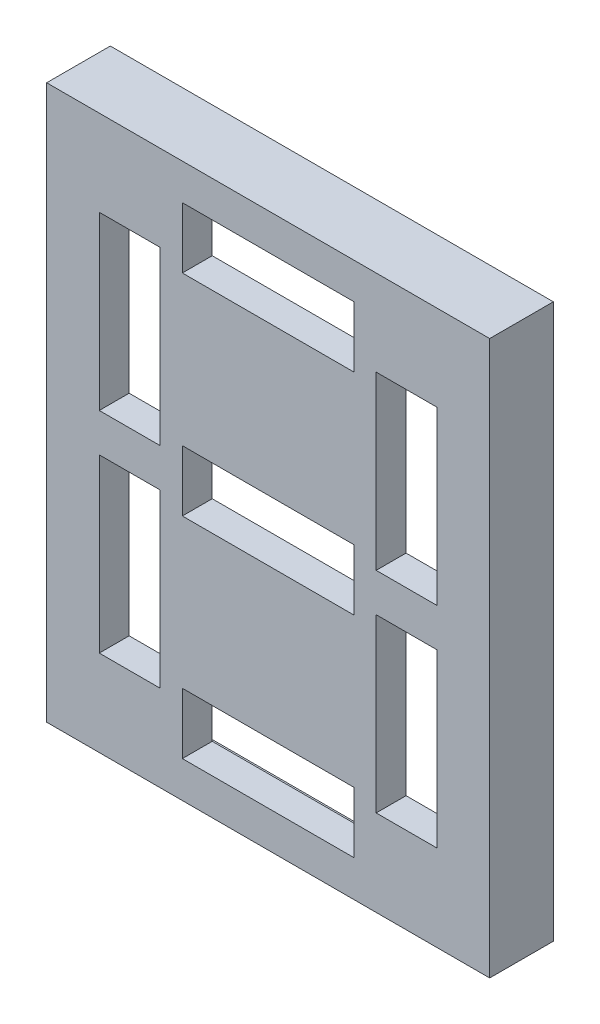
from build123d import *

# Parameters (mm, degrees)
SKETCH1_W             = 11
SKETCH1_H             = 31
BOSS_EXTRUDE1_DEPTH   = 3.81
SKETCH1_W_2           = 31
SKETCH1_H_2           = 11
BOSS_EXTRUDE1_2_DEPTH = 3.81
BOSS_EXTRUDE1_3_DEPTH = 3.81
BOSS_EXTRUDE1_4_DEPTH = 3.81
BOSS_EXTRUDE1_5_DEPTH = 3.81
SKETCH1_W_3           = 80
SKETCH1_H_3           = 100
SKETCH1_W_4           = 78.5
SKETCH1_H_4           = 98.5
BOSS_EXTRUDE1_6_DEPTH = 3.81
SKETCH3_W             = 80
SKETCH3_H             = 100
SKETCH3_W_2           = 31
SKETCH3_H_2           = 11
SKETCH3_W_3           = 11
SKETCH3_H_3           = 31
BOSS_EXTRUDE2_DEPTH   = 1.5875
FILLET1_R             = 0.05
SKETCH9_W             = 80
SKETCH9_H             = 100
BOSS_EXTRUDE6_DEPTH   = 6.096


with BuildPart() as part:
    # Sketch1 → Boss-Extrude1 (new body)
    with BuildSketch(Plane.XY):
        Polygon((-26.313903431, 0.439060111), (-31.5, 2.5), (-31.5, 35.5), (-25.083245041, 38.05), (-18.5, 35.5), (-18.5, 2.5), (-23.846750882, 0.428952262), (-23.616775358, 0.03062297), (-23.846750882, -0.367706323), (-18.5, -2.438754061), (-18.5, -35.438754061), (-25.083245041, -37.988754061), (-31.5, -35.438754061), (-31.5, -2.438754061), (-26.313903431, -0.377814172), (-26.549714725, 0.03062297), align=None)
        with Locations((-25, -18.938754061)):
            Rectangle(SKETCH1_W, SKETCH1_H, mode=Mode.SUBTRACT)
        with Locations((-25, 19)):
            Rectangle(SKETCH1_W, SKETCH1_H, mode=Mode.SUBTRACT)
    extrude(amount=BOSS_EXTRUDE1_DEPTH)



with BuildPart() as body_2:
    # Sketch1 → Boss-Extrude1 2 (new body)
    with BuildSketch(Plane.XY):
        Polygon((-19.05, 0.03062297), (-16.5, 6.5), (16.5, 6.5), (19.05, 0.03062297), (16.5, -6.438754061), (-16.5, -6.438754061), align=None)
        Rectangle(SKETCH1_W_2, SKETCH1_H_2, mode=Mode.SUBTRACT)
    extrude(amount=BOSS_EXTRUDE1_2_DEPTH)


with BuildPart() as body_3:
    # Sketch1 → Boss-Extrude1 3 (new body)
    with BuildSketch(Plane.XY):
        Polygon((26.313903431, 0.439060111), (26.549714725, 0.03062297), (26.313903431, -0.377814172), (31.5, -2.438754061), (31.5, -35.438754061), (25.083245041, -37.988754061), (18.5, -35.438754061), (18.5, -2.438754061), (23.846750882, -0.367706323), (23.616775358, 0.03062297), (23.846750882, 0.428952262), (18.5, 2.5), (18.5, 35.5), (25.083245041, 38.05), (31.5, 35.5), (31.5, 2.5), align=None)
        with Locations((25, 19)):
            Rectangle(SKETCH1_W, SKETCH1_H, mode=Mode.SUBTRACT)
        with Locations((25, -18.938754061)):
            Rectangle(SKETCH1_W, SKETCH1_H, mode=Mode.SUBTRACT)
    extrude(amount=BOSS_EXTRUDE1_3_DEPTH)


with BuildPart() as body_4:
    # Sketch1 → Boss-Extrude1 4 (new body)
    with BuildSketch(Plane.XY):
        Polygon((-16.5, 31.52602227), (-19.05, 38.013011135), (-16.5, 44.5), (16.5, 44.5), (19.05, 38.013011135), (16.5, 31.52602227), align=None)
        with Locations((0, 38)):
            Rectangle(SKETCH1_W_2, SKETCH1_H_2, mode=Mode.SUBTRACT)
    extrude(amount=BOSS_EXTRUDE1_4_DEPTH)


with BuildPart() as body_5:
    # Sketch1 → Boss-Extrude1 5 (new body)
    with BuildSketch(Plane.XY):
        Polygon((16.5, -31.464776331), (19.05, -37.951765196), (16.5, -44.438754061), (-16.5, -44.438754061), (-19.05, -37.951765196), (-16.5, -31.464776331), align=None)
        with Locations((0, -37.938754061)):
            Rectangle(SKETCH1_W_2, SKETCH1_H_2, mode=Mode.SUBTRACT)
    extrude(amount=BOSS_EXTRUDE1_5_DEPTH)


with BuildPart() as body_6:
    # Sketch1 → Boss-Extrude1 6 (new body)
    with BuildSketch(Plane.XY):
        Rectangle(SKETCH1_W_3, SKETCH1_H_3)
        Rectangle(SKETCH1_W_4, SKETCH1_H_4, mode=Mode.SUBTRACT)
    extrude(amount=BOSS_EXTRUDE1_6_DEPTH)


with BuildPart() as part_1:
    add(part.part)

    add(body_2.part)  # Boss-Extrude2 merges body 2

    add(body_3.part)  # Boss-Extrude2 merges body 3

    add(body_4.part)  # Boss-Extrude2 merges body 4

    add(body_5.part)  # Boss-Extrude2 merges body 5

    add(body_6.part)  # Boss-Extrude2 merges body 6
    # Sketch3 → Boss-Extrude2 (add)
    with BuildSketch(Plane.XY.offset(3.81)):
        Rectangle(SKETCH3_W, SKETCH3_H)
        with Locations((0, -37.938754061)):
            Rectangle(SKETCH3_W_2, SKETCH3_H_2, mode=Mode.SUBTRACT)
        Rectangle(SKETCH3_W_2, SKETCH3_H_2, mode=Mode.SUBTRACT)
        with Locations((-25, -18.938754061)):
            Rectangle(SKETCH3_W_3, SKETCH3_H_3, mode=Mode.SUBTRACT)
        with Locations((-25, 19)):
            Rectangle(SKETCH3_W_3, SKETCH3_H_3, mode=Mode.SUBTRACT)
        with Locations((0, 38)):
            Rectangle(SKETCH3_W_2, SKETCH3_H_2, mode=Mode.SUBTRACT)
        with Locations((25, 19)):
            Rectangle(SKETCH3_W_3, SKETCH3_H_3, mode=Mode.SUBTRACT)
        with Locations((25, -18.938754061)):
            Rectangle(SKETCH3_W_3, SKETCH3_H_3, mode=Mode.SUBTRACT)
    extrude(amount=BOSS_EXTRUDE2_DEPTH)

    # Fillet1
    fillet1_edges = [part_1.edges().sort_by_distance(p)[0] for p in [
        (39.25, 49.25, 1.905),
        (39.25, -49.25, 1.905),
        (-39.25, -49.25, 1.905),
        (-39.25, 49.25, 1.905),
    ]]
    fillet(fillet1_edges, radius=FILLET1_R)

    # Sketch9 → Boss-Extrude6 (add)
    with BuildSketch(Plane(origin=(0, 0, 0), x_dir=(-1, 0, 0), z_dir=(0, 0, -1))):
        Rectangle(SKETCH9_W, SKETCH9_H)
        with BuildLine():
            Line((39.2, 49.25), (-39.2, 49.25))
            ThreePointArc((-39.2, 49.25), (-39.235355339, 49.235355339), (-39.25, 49.2))
            Line((-39.25, 49.2), (-39.25, -49.2))
            ThreePointArc((-39.25, -49.2), (-39.235355339, -49.235355339), (-39.2, -49.25))
            Line((-39.2, -49.25), (39.2, -49.25))
            ThreePointArc((39.2, -49.25), (39.235355339, -49.235355339), (39.25, -49.2))
            Line((39.25, -49.2), (39.25, 49.2))
            ThreePointArc((39.25, 49.2), (39.235355339, 49.235355339), (39.2, 49.25))
        make_face(mode=Mode.SUBTRACT)
    extrude(amount=BOSS_EXTRUDE6_DEPTH)


solid = part_1.part
